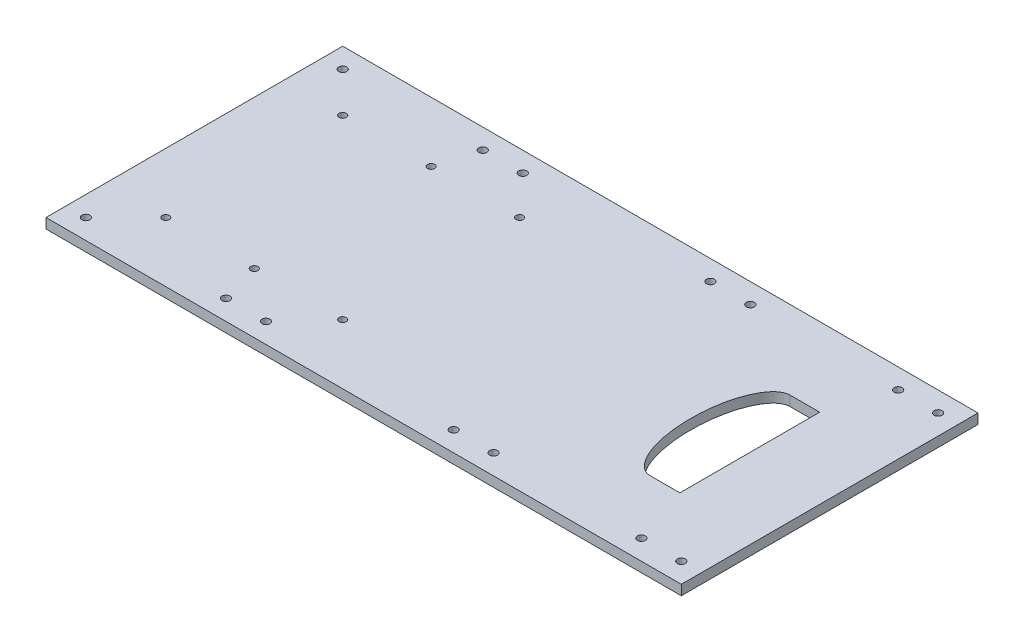
from build123d import *

# Parameters (mm, degrees)
ESQUISSE2_W              = 318.15
ESQUISSE2_H              = 148.59
BOSS_EXTRU_1_DEPTH       = 5
ESQUISSE3_R              = 2
ENL_V_MAT_EXTRU_1_DEPTH  = 5
ESQUISSE8_R              = 1.8
ENL_V_MAT_EXTRU_5_DEPTH  = 5
ESQUISSE9_R              = 2
ENL_V_MAT_EXTRU_6_DEPTH  = 10
ESQUISSE10_R             = 2
ENL_V_MAT_EXTRU_8_DEPTH  = 10
ENL_V_MAT_EXTRU_10_DEPTH = 10


with BuildPart() as part:
    # Esquisse2 → Boss.-Extru.1 (new body)
    with BuildSketch(Plane(origin=(0, 0, 0), x_dir=(1, 0, 0), z_dir=(0, 1, 0))):
        with Locations((127.309454852, -77.182817805)):
            Rectangle(ESQUISSE2_W, ESQUISSE2_H)
    extrude(amount=BOSS_EXTRU_1_DEPTH)

    # Esquisse3 → Enlèv. mat.-Extru.1 (cut)
    with BuildSketch(Plane(origin=(0, 5, 0), x_dir=(1, 0, 0), z_dir=(0, 1, 0))):
        with Locations(Location((276.384454852, -141.477817805, 0), (0, 0, 270))):
            Circle(ESQUISSE3_R)
        with Locations(Location((276.384454852, -12.887817805, 0), (0, 0, 270))):
            Circle(ESQUISSE3_R)
        with Locations(Location((-21.765545148, -12.887817805, 0), (0, 0, 270))):
            Circle(ESQUISSE3_R)
        with Locations(Location((-21.765545148, -141.477817805, 0), (0, 0, 270))):
            Circle(ESQUISSE3_R)
    extrude(amount=-ENL_V_MAT_EXTRU_1_DEPTH, mode=Mode.SUBTRACT)

    # Esquisse8 → Enlèv. mat.-Extru.5 (cut)
    with BuildSketch(Plane.XZ):
        with Locations(Location((-1.765545148, 121.477817805, 0), (0, 0, 270))):
            Circle(ESQUISSE8_R)
        with Locations(Location((-1.765545148, 32.887817805, 0), (0, 0, 270))):
            Circle(ESQUISSE8_R)
        with Locations(Location((42.529454852, 121.477817805, 0), (0, 0, 270))):
            Circle(ESQUISSE8_R)
        with Locations(Location((42.529454852, 32.887817805, 0), (0, 0, 270))):
            Circle(ESQUISSE8_R)
        with Locations(Location((86.824454852, 32.887817805, 0), (0, 0, 270))):
            Circle(ESQUISSE8_R)
        with Locations(Location((86.824454852, 121.477817805, 0), (0, 0, 270))):
            Circle(ESQUISSE8_R)
    extrude(amount=-ENL_V_MAT_EXTRU_5_DEPTH, mode=Mode.SUBTRACT)

    # Esquisse9 → Enlèv. mat.-Extru.6 (cut)
    with BuildSketch(Plane.XZ):
        with Locations(Location((182.384454852, 12.887817805, 0), (0, 0, 270))):
            Circle(ESQUISSE9_R)
        with Locations(Location((162.384454852, 12.887817805, 0), (0, 0, 270))):
            Circle(ESQUISSE9_R)
        with Locations(Location((182.384454852, 141.477817805, 0), (0, 0, 270))):
            Circle(ESQUISSE9_R)
        with Locations(Location((162.384454852, 141.477817805, 0), (0, 0, 270))):
            Circle(ESQUISSE9_R)
        with Locations(Location((68.384454852, 141.477817805, 0), (0, 0, 270))):
            Circle(ESQUISSE9_R)
        with Locations(Location((68.384454852, 12.887817805, 0), (0, 0, 270))):
            Circle(ESQUISSE9_R)
        with Locations(Location((48.384454852, 12.887817805, 0), (0, 0, 270))):
            Circle(ESQUISSE9_R)
        with Locations(Location((48.384454852, 141.477817805, 0), (0, 0, 270))):
            Circle(ESQUISSE9_R)
    extrude(amount=-ENL_V_MAT_EXTRU_6_DEPTH, mode=Mode.SUBTRACT)

    # Esquisse10 → Enlèv. mat.-Extru.8 (cut)
    with BuildSketch(Plane.XZ):
        with Locations(Location((256.384454852, 12.887817805, 0), (0, 0, 270))):
            Circle(ESQUISSE10_R)
        with Locations(Location((256.384454852, 141.477817805, 0), (0, 0, 270))):
            Circle(ESQUISSE10_R)
    extrude(amount=-ENL_V_MAT_EXTRU_8_DEPTH, mode=Mode.SUBTRACT)

    # Esquisse11 → Enlèv. mat.-Extru.10 (cut)
    with BuildSketch(Plane.XZ):
        with BuildLine():
            Line((231.591274663, 42.182817805), (246.384454852, 42.182817805))
            Line((246.384454852, 42.182817805), (246.384454852, 112.182817805))
            Line((246.384454852, 112.182817805), (231.591274663, 112.182817805))
            add(Edge.make_bspline(
                [(231.591274663, 112.182817805), (216.798094475, 112.182817805), (216.798094475, 77.182817805), (216.798094475, 42.182817805), (231.591274663, 42.182817805)],
                knots=[0, 0, 0, 1.570796327, 1.570796327, 3.141592654, 3.141592654, 3.141592654], degree=2, weights=[1, 0.707106781, 1, 0.707106781, 1]))
        make_face()
    extrude(amount=-ENL_V_MAT_EXTRU_10_DEPTH, mode=Mode.SUBTRACT)


solid = part.part
